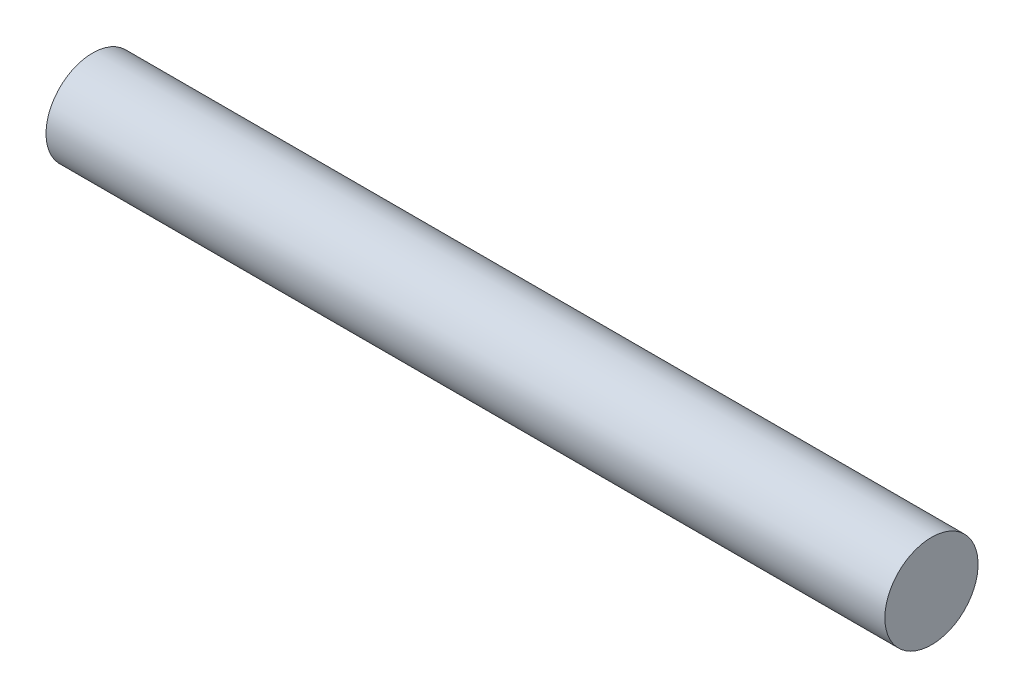
from build123d import *

# Parameters (mm, degrees)
SKETCH1_R           = 2.5
BOSS_EXTRUDE1_DEPTH = 22.5


with BuildPart() as part:
    # Sketch1 → Boss-Extrude1 (new, symmetric)
    with BuildSketch(Plane(origin=(0, 0, 0), x_dir=(0, 0, -1), z_dir=(1, 0, 0))):
        with Locations(Location((0, 0, 0), (0, 0, 180))):
            Circle(SKETCH1_R)
    extrude(amount=BOSS_EXTRUDE1_DEPTH, both=True)


solid = part.part
